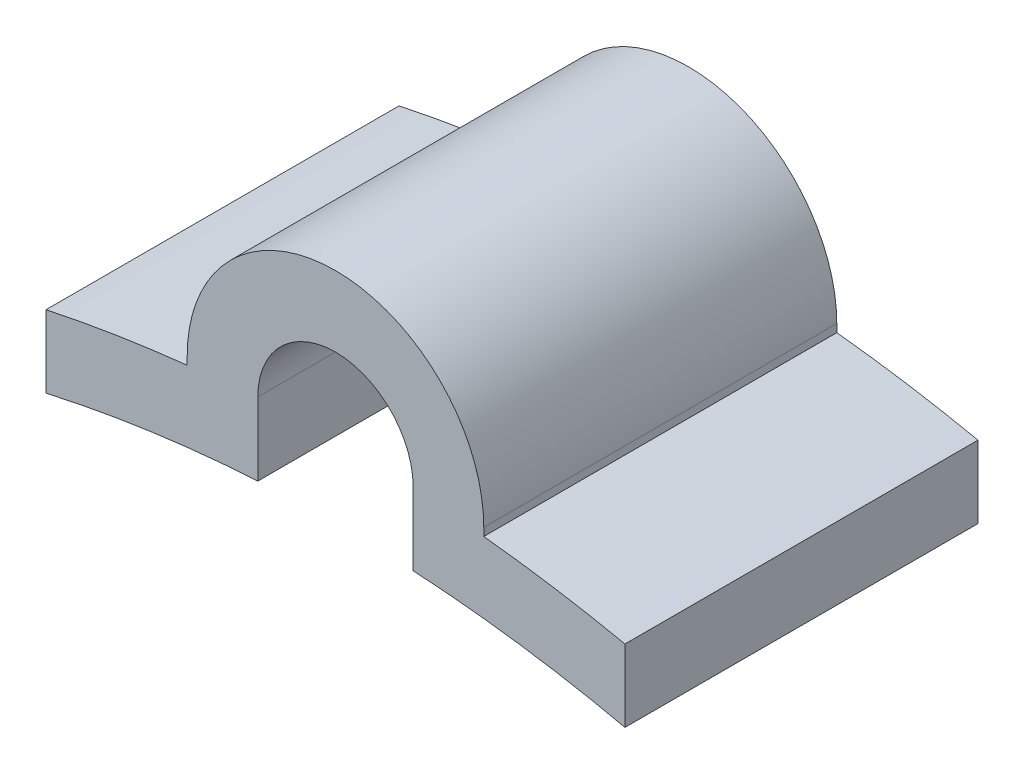
from build123d import *

# Parameters (mm, degrees)
BOSS_EXTRUDE1_DEPTH = 10


with BuildPart() as part:
    # Sketch1 → Boss-Extrude1 (new body)
    with BuildSketch(Plane.XY):
        with BuildLine():
            Line((-4.2, 0), (-4.2, -0.223925858))
            ThreePointArc((-4.2, -0.223925858), (-6.208164835, -0.490915297), (-8.2, -0.860512426))
            Line((-8.2, -0.860512426), (-8.2, -2.907514433))
            ThreePointArc((-8.2, -2.907514433), (-5.21705193, -2.364674915), (-2.2, -2.064588956))
            Line((-2.2, -2.064588956), (-2.2, 0))
            ThreePointArc((-2.2, 0), (0, 2.2), (2.2, 0))
            Line((2.2, 0), (2.2, -2.064588956))
            ThreePointArc((2.2, -2.064588956), (5.21705193, -2.364674915), (8.2, -2.907514433))
            Line((8.2, -2.907514433), (8.2, -0.860512426))
            ThreePointArc((8.2, -0.860512426), (6.208164835, -0.490915297), (4.2, -0.223925858))
            Line((4.2, -0.223925858), (4.2, 0))
            ThreePointArc((4.2, 0), (0, 4.2), (-4.2, 0))
        make_face()
    extrude(amount=BOSS_EXTRUDE1_DEPTH)


solid = part.part
